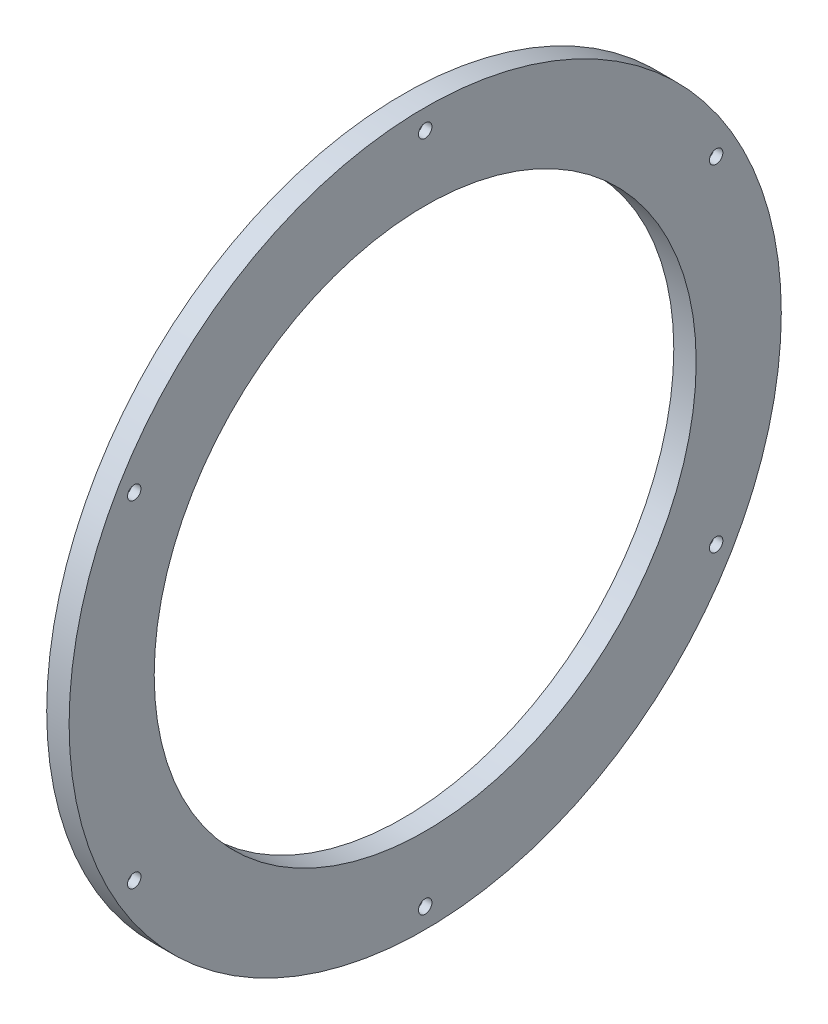
from build123d import *

# Parameters (mm, degrees)
SKETCH1_R                               = 159
SKETCH1_R_2                             = 121
BOSS_EXTRUDE1_DEPTH                     = 10
CBORE_FOR_M5_HEX_HEAD_BOLT2_D           = 6
CBORE_FOR_M5_HEX_HEAD_BOLT2_DEPTH       = 13
CBORE_FOR_M5_HEX_HEAD_BOLT2_CBORE_D     = 12
CBORE_FOR_M5_HEX_HEAD_BOLT2_CBORE_DEPTH = 6
CBORE_FOR_M5_HEX_HEAD_BOLT2_TIP         = 1.802581857


with BuildPart() as part:
    # Sketch1 → Boss-Extrude1 (new body)
    with BuildSketch(Plane(origin=(0, 0, 0), x_dir=(0, 0, -1), z_dir=(1, 0, 0))):
        Circle(SKETCH1_R)
        Circle(SKETCH1_R_2, mode=Mode.SUBTRACT)
    extrude(amount=BOSS_EXTRUDE1_DEPTH)

    # CBORE for M5 Hex Head Bolt2
    with Locations(Plane.ZY):
        with Locations((0, 150), (129.903810568, 75), (129.903810568, -75), (0, -150), (-129.903810568, -75), (-129.903810568, 75), (0, 0)):
            CounterBoreHole(CBORE_FOR_M5_HEX_HEAD_BOLT2_D / 2, CBORE_FOR_M5_HEX_HEAD_BOLT2_CBORE_D / 2, CBORE_FOR_M5_HEX_HEAD_BOLT2_CBORE_DEPTH, depth=CBORE_FOR_M5_HEX_HEAD_BOLT2_DEPTH)
            with Locations((0, 0, -(CBORE_FOR_M5_HEX_HEAD_BOLT2_DEPTH + CBORE_FOR_M5_HEX_HEAD_BOLT2_TIP / 2))):  # 118° drill point
                Cone(0, CBORE_FOR_M5_HEX_HEAD_BOLT2_D / 2, CBORE_FOR_M5_HEX_HEAD_BOLT2_TIP, mode=Mode.SUBTRACT)


solid = part.part
